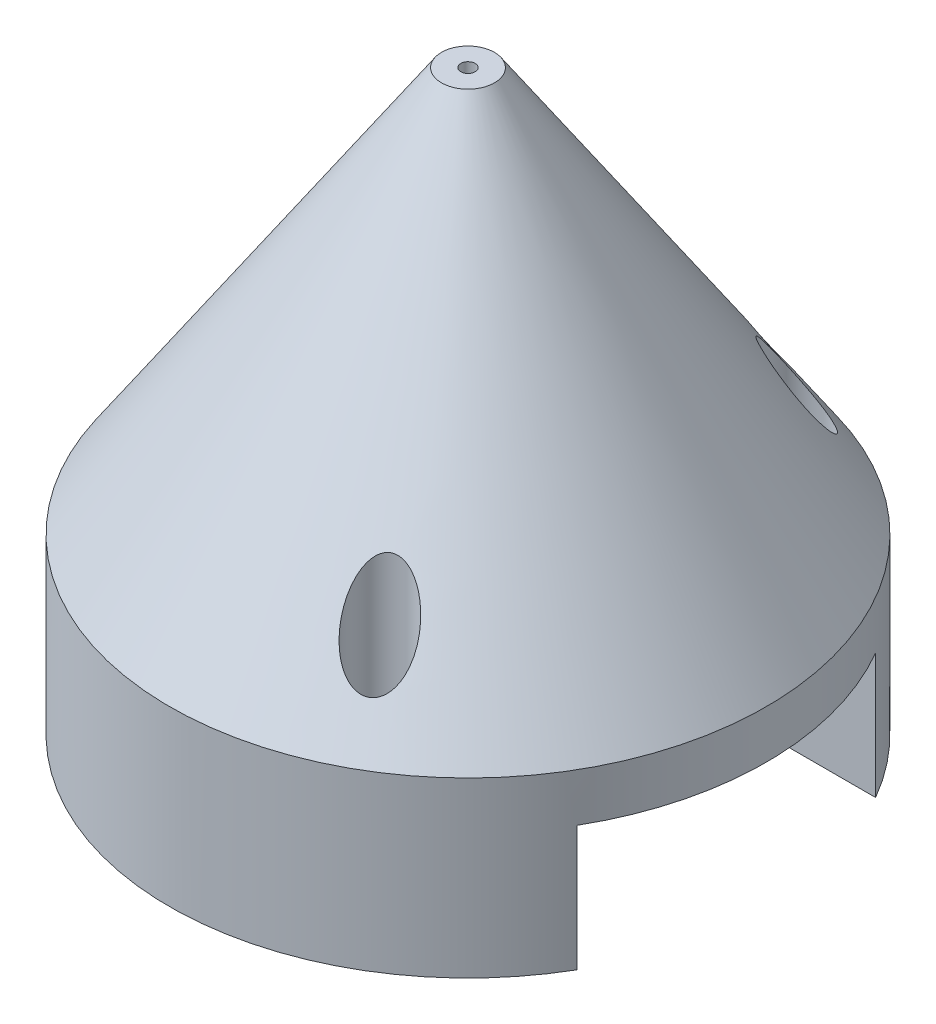
from build123d import *

# Parameters (mm, degrees)
SKETCH2_W          = 40.136410409
SKETCH2_H          = 31
CUT_EXTRUDE1_DEPTH = 13
CUT_EXTRUDE3_START = -10
SKETCH4_R          = 3
CUT_EXTRUDE3_DEPTH = 73.147907447
SKETCH5_R          = 1.6
CUT_EXTRUDE4_DEPTH = 70.299079528
CIRPATTERN1_COUNT  = 3
CHAMFER1_SIZE      = 2.5
CHAMFER1_SIZE2     = 1.443375673


with BuildPart() as part:
    # Sketch1 → Revolve1 (revolve)
    with BuildSketch(Plane.XY):
        Polygon((-5.474803929, 60), (-33.724803929, 18), (-33.724803929, 0), (-22.724803929, 0), (-22.724803929, 13), (-3.474803929, 13), (-3.474803929, 60), align=None)
    revolve(axis=Axis((-2.724803929, 66.831705954, 0), (0, -1, 0)))

    # Sketch2 → Cut-Extrude1 (cut)
    with BuildSketch(Plane.XZ):
        with Locations((24.032962091, 0)):
            Rectangle(SKETCH2_W, SKETCH2_H)
    extrude(amount=-CUT_EXTRUDE1_DEPTH, mode=Mode.SUBTRACT)

    # Sketch4 → Cut-Extrude3 (cut)
    with BuildSketch(Plane(origin=(0, 18, 0), x_dir=(-1, 0, 0), z_dir=(0, 1, 0)).offset(CUT_EXTRUDE3_START)):
        with Locations(Location((27.724803929, 0, 0), (0, 0, 179.999995067))):
            Circle(SKETCH4_R)
    cut_extrude3 = extrude(amount=CUT_EXTRUDE3_DEPTH, mode=Mode.SUBTRACT)

    # Sketch5 → Cut-Extrude4 (cut, through all)
    with BuildSketch(Plane(origin=(0, 8, 0), x_dir=(1, 0, 0), z_dir=(0, 1, 0))):
        with Locations(Location((-27.724803929, 0, 0), (0, 0, 180))):
            Circle(SKETCH5_R)
    cut_extrude4 = extrude(amount=-CUT_EXTRUDE4_DEPTH, mode=Mode.SUBTRACT)

    # CirPattern1: Cut-Extrude3, Cut-Extrude4 ×3 about axis
    cirpattern1_axis = Axis((-2.724803929, 0, 0), (0, 1, 0))
    add([cut_extrude3.rotate(cirpattern1_axis, i * 360 / CIRPATTERN1_COUNT) for i in range(1, CIRPATTERN1_COUNT)], mode=Mode.SUBTRACT)
    add([cut_extrude4.rotate(cirpattern1_axis, i * 360 / CIRPATTERN1_COUNT) for i in range(1, CIRPATTERN1_COUNT)], mode=Mode.SUBTRACT)

    # Chamfer1
    chamfer1_edges = [part.edges().sort_by_distance(p)[0] for p in [
        (-1.974803929, 13, 0),
    ]]
    chamfer1_side = [part.faces().sort_by_distance(p)[0] for p in [
        (-1.974803929, 36.5, 0),
    ]]
    chamfer(chamfer1_edges, length=CHAMFER1_SIZE, length2=CHAMFER1_SIZE2, reference=chamfer1_side[0])


solid = part.part
